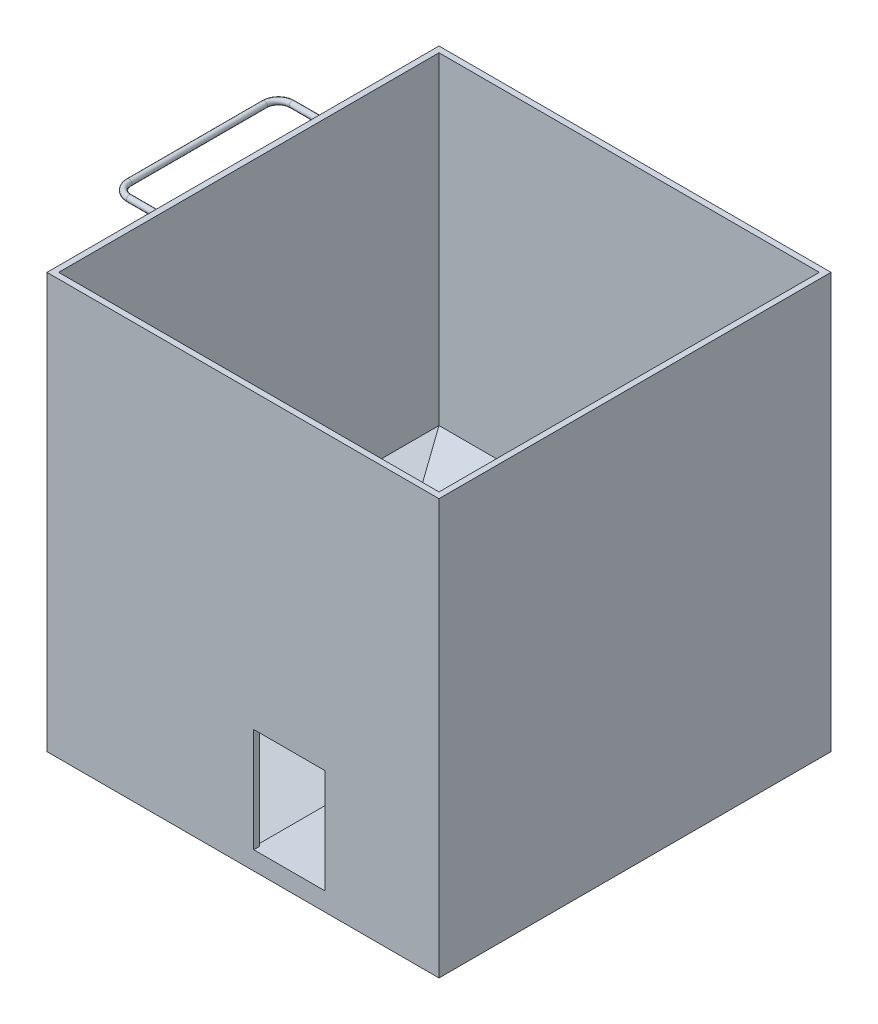
from build123d import *

# Parameters (mm, degrees)
CROQUIS1_W              = 850
CROQUIS1_H              = 850
SALIENTE_EXTRUIR1_DEPTH = 700
VACIADO1_T              = -12.7
CROQUIS2_W              = 850
CROQUIS2_H              = 850
SALIENTE_EXTRUIR2_DEPTH = 200
CROQUIS3_W              = 150
CROQUIS3_H              = 50
CORTAR_EXTRUIR1_DEPTH   = 90
BARRER4_PROFILE_R       = 6.35
CORTAR_EXTRUIR2_REACH   = 1385.319
CROQUIS28_W             = 154.421889756
CROQUIS28_H             = 225.805379595


with BuildPart() as part:
    # Croquis1 → Saliente-Extruir1 (new body)
    with BuildSketch(Plane(origin=(0, 0, 0), x_dir=(1, 0, 0), z_dir=(0, 1, 0))):
        with Locations((425, 425)):
            Rectangle(CROQUIS1_W, CROQUIS1_H)
    extrude(amount=SALIENTE_EXTRUIR1_DEPTH)

    # Vaciado1
    vaciado1_openings = [part.faces().sort_by_distance(p)[0] for p in [
        (425, 700, -425),
        (425, 0, -425),
    ]]
    offset(amount=VACIADO1_T, openings=vaciado1_openings, kind=Kind.INTERSECTION)

    # Croquis2 → Saliente-Extruir2 (add)
    with BuildSketch(Plane.XZ):
        with Locations((425, -425)):
            Rectangle(CROQUIS2_W, CROQUIS2_H)
    extrude(amount=SALIENTE_EXTRUIR2_DEPTH)

    # Croquis3 → Cortar-Extruir1 (cut)
    with BuildSketch(Plane.XZ.offset(200)):
        with Locations((154.404863241, -80.611350772)):
            Rectangle(CROQUIS3_W, CROQUIS3_H)
        with Locations((695.595136759, -80.611350772)):
            Rectangle(CROQUIS3_W, CROQUIS3_H)
        with Locations((154.404863241, -769.388649228)):
            Rectangle(CROQUIS3_W, CROQUIS3_H)
        with Locations((695.595136759, -769.388649228)):
            Rectangle(CROQUIS3_W, CROQUIS3_H)
    extrude(amount=-CORTAR_EXTRUIR1_DEPTH, mode=Mode.SUBTRACT)

    # Croquis8 → Cortar-Recubrir1 section 0
    with BuildSketch(Plane(origin=(0, 0, 0), x_dir=(1, 0, 0), z_dir=(0, 1, 0))):
        with BuildLine():
            Line((12.7, 12.7), (837.3, 12.7))
            Line((837.3, 12.7), (837.3, 837.3))
            Line((837.3, 837.3), (12.7, 837.3))
            Line((12.7, 837.3), (12.7, 12.7))
        make_face()
    # Croquis6 → Cortar-Recubrir1 section 1
    with BuildSketch(Plane(origin=(0, -160, 0), x_dir=(-1, 0, 0), z_dir=(0, -1, 0))):
        with BuildLine():
            Line((-602.765132653, 12.7), (-442.765132653, 12.7))
            Line((-442.765132653, 12.7), (-442.765132653, 172.7))
            Line((-442.765132653, 172.7), (-602.765132653, 172.7))
            Line((-602.765132653, 172.7), (-602.765132653, 12.7))
        make_face()
    loft(mode=Mode.SUBTRACT)

    # Barrer4: sweep along a path in Croquis11
    with BuildLine(Plane(origin=(0, 680, 0), x_dir=(1, 0, 0), z_dir=(0, 1, 0))) as barrer4_path:
        Line((0, 248.298675653), (-70, 248.298675653))
        ThreePointArc((-70, 248.298675653), (-91.213203436, 257.085472217), (-100, 278.298675653))
        Line((-100, 278.298675653), (-100, 571.701324347))
        ThreePointArc((-100, 571.701324347), (-91.213203436, 592.914527783), (-70, 601.701324347))
        Line((-70, 601.701324347), (0, 601.701324347))
    # Barrer4 profile (on start of the path) → Barrer4 (sweep)
    with BuildSketch(Plane(origin=(0, 680, -248.298675653), x_dir=(0, 0, -1), z_dir=(-1, 0, 0))):
        Circle(BARRER4_PROFILE_R)
    sweep(path=barrer4_path.line)

    # Croquis28 → Cortar-Extruir2 (cut, up to next)
    with BuildSketch(Plane(origin=(0, 0, -12.7), x_dir=(-1, 0, 0), z_dir=(0, 0, -1)), mode=Mode.PRIVATE) as cortar_extruir2_sk1:
        with Locations((-525.554187775, -47.097310202)):
            Rectangle(CROQUIS28_W, CROQUIS28_H)
    cortar_extruir2_tool1 = extrude(cortar_extruir2_sk1.sketch, amount=-CORTAR_EXTRUIR2_REACH, mode=Mode.PRIVATE) & part.part
    add(cortar_extruir2_tool1.solids().sort_by_distance((525.554188, -47.09731, -12.7))[0], mode=Mode.SUBTRACT)


solid = part.part
